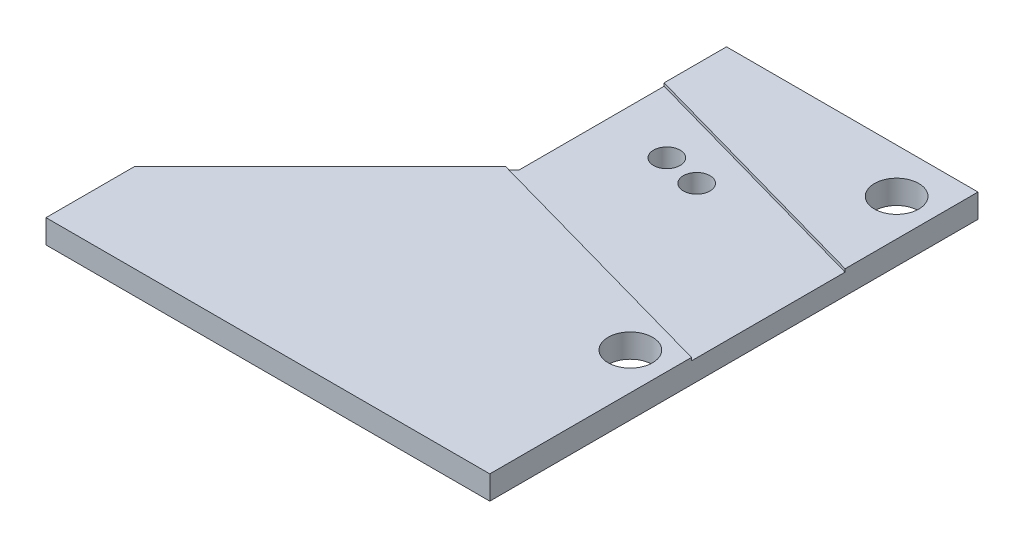
from build123d import *

# Parameters (mm, degrees)
EXTRUSION1_DEPTH        = 1.6
ESQUISSE2_R             = 0.9
ENL_V_MAT_EXTRU_1_DEPTH = 37.654604076
ENL_V_MAT_EXTRU_2_DEPTH = 0.2
ESQUISSE4_R             = 1.5
ENL_V_MAT_EXTRU_3_DEPTH = 37.654604076


with BuildPart() as part:
    # Esquisse1 → Extrusion1 (new body)
    with BuildSketch(Plane(origin=(0, 0, 0), x_dir=(1, 0, 0), z_dir=(0, 1, 0))):
        Polygon((-17, 12), (0, 12), (0, -21), (-30, -21), (-30, -15), (-17, -2), align=None)
    extrude(amount=EXTRUSION1_DEPTH)

    # Esquisse2 → Enlèv. mat.-Extru.1 (cut, through all)
    with BuildSketch(Plane(origin=(0, 1.6, 0), x_dir=(1, 0, 0), z_dir=(0, 1, 0))):
        with Locations(Location((-12.719630786, 3.685060513, 0), (0, 0, 270))):
            Circle(ESQUISSE2_R)
        with Locations(Location((-10.215884924, 3.201576633, 0), (0, 0, 270))):
            Circle(ESQUISSE2_R)
    extrude(amount=-ENL_V_MAT_EXTRU_1_DEPTH, mode=Mode.SUBTRACT)

    # Esquisse3 → Enlèv. mat.-Extru.2 (cut)
    with BuildSketch(Plane(origin=(0, 1.6, 0), x_dir=(1, 0, 0), z_dir=(0, 1, 0))):
        Polygon((-17, 7.782827883), (-17, -2), (-17.470712916, -2.470712916), (0, -7.368289602), (0, 3.017206465), align=None)
    extrude(amount=-ENL_V_MAT_EXTRU_2_DEPTH, mode=Mode.SUBTRACT)

    # Esquisse4 → Enlèv. mat.-Extru.3 (cut, through all)
    with BuildSketch(Plane(origin=(0, 1.6, 0), x_dir=(1, 0, 0), z_dir=(0, 1, 0))):
        with Locations(Location((-2.5, 9, 0), (0, 0, 270))):
            Circle(ESQUISSE4_R)
        with Locations(Location((-2.5, -9, 0), (0, 0, 270))):
            Circle(ESQUISSE4_R)
    extrude(amount=-ENL_V_MAT_EXTRU_3_DEPTH, mode=Mode.SUBTRACT)


solid = part.part
